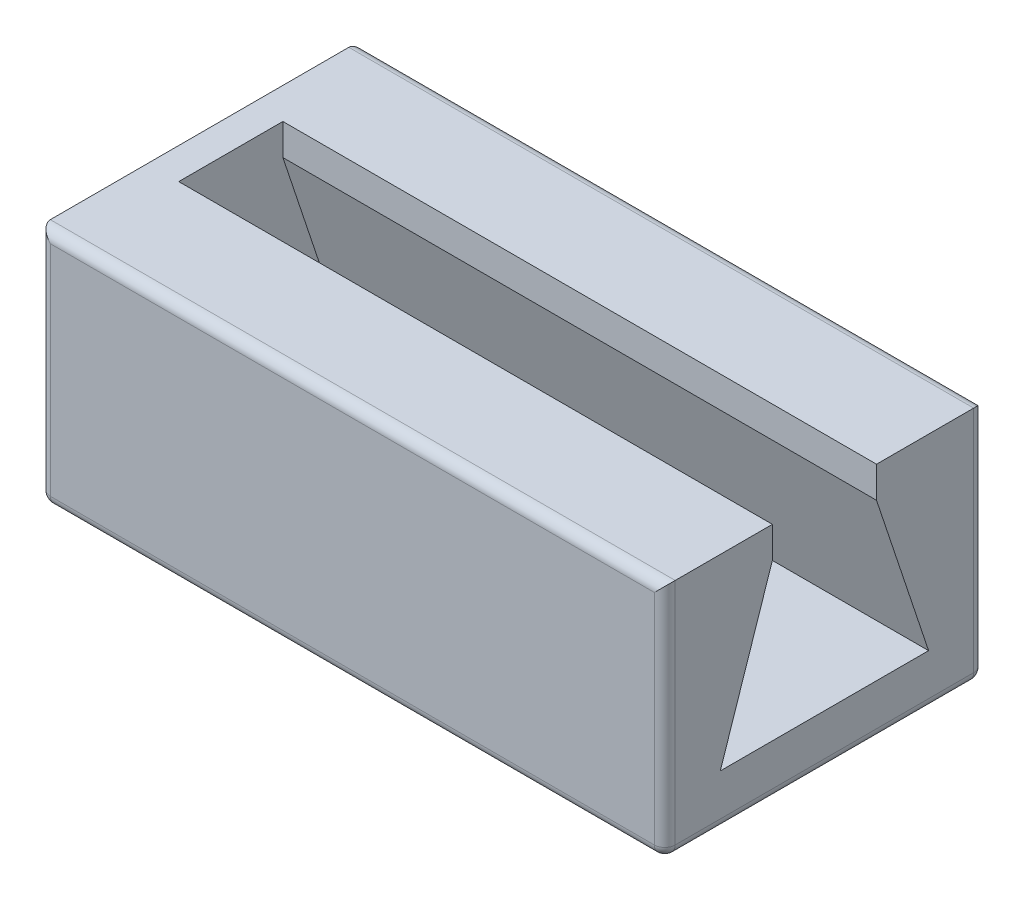
from build123d import *

# Parameters (mm, degrees)
BOSS_EXTRUDE1_DEPTH = 60
FILLET1_R           = 1
BOSS_EXTRUDE2_DEPTH = 3


with BuildPart() as part:
    # Sketch2 → Boss-Extrude1 (new body)
    with BuildSketch(Plane(origin=(0, 0, 0), x_dir=(0, 0, -1), z_dir=(1, 0, 0))):
        Polygon((0, 0), (0, 23), (10.33, 23), (10.33, 20), (5.33, 4.995680218), (25.33, 4.995680218), (20.33, 20), (20.33, 23), (30.66, 23), (30.66, 0), align=None)
    extrude(amount=BOSS_EXTRUDE1_DEPTH)

    # Fillet1
    fillet1_edges = [part.edges().sort_by_distance(p)[0] for p in [
        (0, 11.5, 0),
        (0, 11.5, -30.66),
        (0, 0, -15.33),
        (30, 0, 0),
        (30, 23, 0),
        (30, 23, -30.66),
        (30, 0, -30.66),
        (60, 11.5, 0),
        (60, 0, -15.33),
        (60, 11.5, -30.66),
    ]]
    fillet(fillet1_edges, radius=FILLET1_R)

    # Sketch3 → Boss-Extrude2 (add)
    with BuildSketch(Plane.ZY):
        Polygon((-20.33, 23), (-10.33, 23), (-10.33, 20), (-5.33, 4.995680218), (-25.33, 4.995680218), (-20.33, 20), align=None)
    extrude(amount=-BOSS_EXTRUDE2_DEPTH)


solid = part.part
